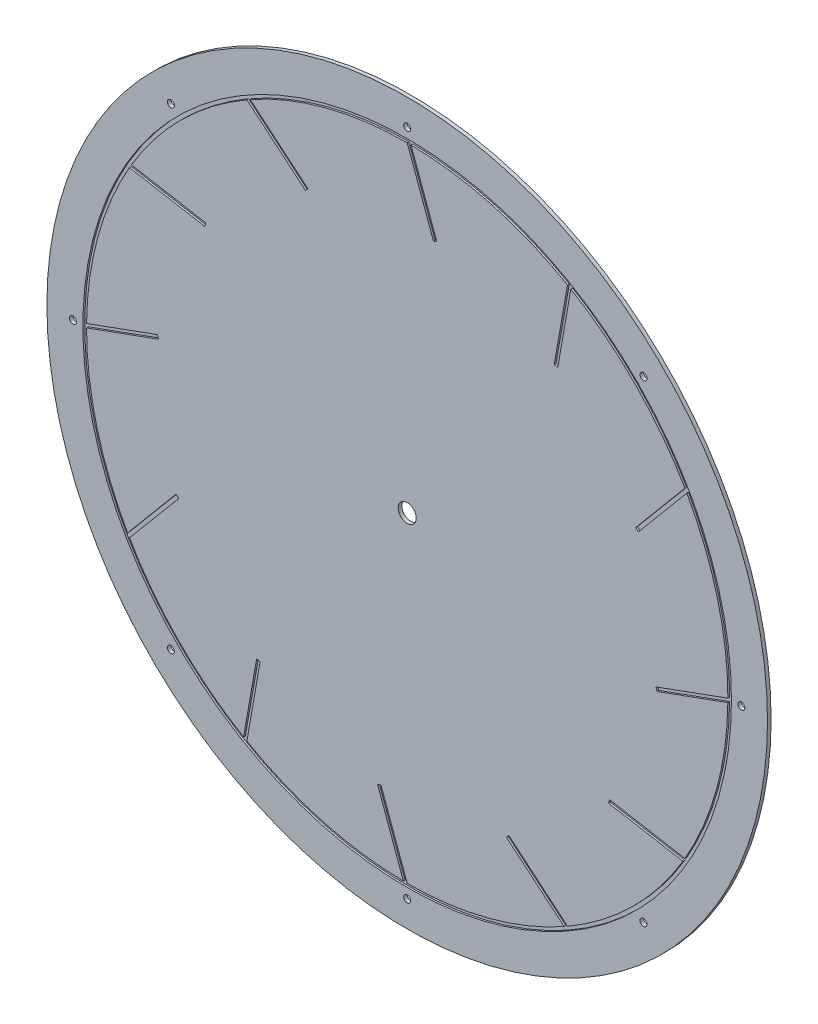
from build123d import *

# Parameters (mm, degrees)
SKETCH1_R                    = 254
BOSS_EXTRUDE1_DEPTH          = 2.54
SKETCH2_R                    = 228.6
SKETCH2_R_2                  = 226.06
CUT_EXTRUDE1_DEPTH           = 1.27
CUT_EXTRUDE2_DEPTH           = 1.27
SKETCH8_R                    = 6.35
CUT_EXTRUDE3_DEPTH           = 360.219224987
F_10_0_1935_DIAMETER_HOLE1_D = 4.9149


with BuildPart() as part:
    # Sketch1 → Boss-Extrude1 (new body)
    with BuildSketch(Plane.XY):
        Circle(SKETCH1_R)
    extrude(amount=BOSS_EXTRUDE1_DEPTH)

    # Sketch2 → Cut-Extrude1 (cut)
    with BuildSketch(Plane.XY.offset(2.54)):
        Circle(SKETCH2_R)
        Circle(SKETCH2_R_2, mode=Mode.SUBTRACT)
    extrude(amount=-CUT_EXTRUDE1_DEPTH, mode=Mode.SUBTRACT)

    # Sketch4 → Cut-Extrude2 (cut)
    with BuildSketch(Plane.XY.offset(2.54)):
        with BuildLine():
            Line((-226.06, 0), (-175.26, 18.489687901))
            Line((-175.26, 18.489687901), (-176.128731164, 20.876507158))
            Line((-176.128731164, 20.876507158), (-226.043768674, 2.708919262))
            ThreePointArc((-226.043768674, 2.708919262), (-226.055942132, 1.354483944), (-226.06, 0))
        make_face()
        with BuildLine():
            Line((-195.77370278, 113.03), (-142.534768317, 103.64253943))
            Line((-142.534768317, 103.64253943), (-142.093701946, 106.143951123))
            Line((-142.093701946, 106.143951123), (-194.405186408, 115.367877234))
            ThreePointArc((-194.405186408, 115.367877234), (-195.092946591, 114.200988571), (-195.77370278, 113.03))
        make_face()
        with BuildLine():
            Line((-113.03, 195.77370278), (-71.61746057, 161.024456218))
            Line((-71.61746057, 161.024456218), (-69.984780041, 162.970209103))
            Line((-69.984780041, 162.970209103), (-110.67589144, 197.11410567))
            ThreePointArc((-110.67589144, 197.11410567), (-111.854953561, 196.447430535), (-113.03, 195.77370278))
        make_face()
        with BuildLine():
            Line((0, 226.06), (18.489687901, 175.26))
            Line((18.489687901, 175.26), (20.876507158, 176.128731164))
            Line((20.876507158, 176.128731164), (2.708919262, 226.043768674))
            ThreePointArc((2.708919262, 226.043768674), (1.354483944, 226.055942132), (0, 226.06))
        make_face()
        with BuildLine():
            Line((113.03, 195.77370278), (103.64253943, 142.534768317))
            Line((103.64253943, 142.534768317), (106.143951123, 142.093701946))
            Line((106.143951123, 142.093701946), (115.367877234, 194.405186408))
            ThreePointArc((115.367877234, 194.405186408), (114.200988571, 195.092946591), (113.03, 195.77370278))
        make_face()
        with BuildLine():
            Line((195.77370278, 113.03), (161.024456218, 71.61746057))
            Line((161.024456218, 71.61746057), (162.970209103, 69.984780041))
            Line((162.970209103, 69.984780041), (197.11410567, 110.67589144))
            ThreePointArc((197.11410567, 110.67589144), (196.447430535, 111.854953561), (195.77370278, 113.03))
        make_face()
        with BuildLine():
            Line((226.06, 0), (175.26, -18.489687901))
            Line((175.26, -18.489687901), (176.128731164, -20.876507158))
            Line((176.128731164, -20.876507158), (226.043768674, -2.708919262))
            ThreePointArc((226.043768674, -2.708919262), (226.055942132, -1.354483944), (226.06, 0))
        make_face()
        with BuildLine():
            Line((195.77370278, -113.03), (142.534768317, -103.64253943))
            Line((142.534768317, -103.64253943), (142.093701946, -106.143951123))
            Line((142.093701946, -106.143951123), (194.405186408, -115.367877234))
            ThreePointArc((194.405186408, -115.367877234), (195.092946591, -114.200988571), (195.77370278, -113.03))
        make_face()
        with BuildLine():
            Line((113.03, -195.77370278), (71.61746057, -161.024456218))
            Line((71.61746057, -161.024456218), (69.984780041, -162.970209103))
            Line((69.984780041, -162.970209103), (110.67589144, -197.11410567))
            ThreePointArc((110.67589144, -197.11410567), (111.854953561, -196.447430535), (113.03, -195.77370278))
        make_face()
        with BuildLine():
            Line((0, -226.06), (-18.489687901, -175.26))
            Line((-18.489687901, -175.26), (-20.876507158, -176.128731164))
            Line((-20.876507158, -176.128731164), (-2.708919262, -226.043768674))
            ThreePointArc((-2.708919262, -226.043768674), (-1.354483944, -226.055942132), (0, -226.06))
        make_face()
        with BuildLine():
            Line((-113.03, -195.77370278), (-103.64253943, -142.534768317))
            Line((-103.64253943, -142.534768317), (-106.143951123, -142.093701946))
            Line((-106.143951123, -142.093701946), (-115.367877234, -194.405186408))
            ThreePointArc((-115.367877234, -194.405186408), (-114.200988571, -195.092946591), (-113.03, -195.77370278))
        make_face()
        with BuildLine():
            Line((-195.77370278, -113.03), (-161.024456218, -71.61746057))
            Line((-161.024456218, -71.61746057), (-162.970209103, -69.984780041))
            Line((-162.970209103, -69.984780041), (-197.11410567, -110.67589144))
            ThreePointArc((-197.11410567, -110.67589144), (-196.447430535, -111.854953561), (-195.77370278, -113.03))
        make_face()
    extrude(amount=-CUT_EXTRUDE2_DEPTH, mode=Mode.SUBTRACT)

    # Sketch8 → Cut-Extrude3 (cut, through all)
    with BuildSketch(Plane(origin=(0, 0, 0), x_dir=(-1, 0, 0), z_dir=(0, 0, -1))):
        Circle(SKETCH8_R)
    extrude(amount=-CUT_EXTRUDE3_DEPTH, mode=Mode.SUBTRACT)

    # #10 (0.1935) Diameter Hole1 (through all)
    with Locations(Plane.XY.offset(2.54)):
        with Locations((-235.585, 0), (-166.583751046, 166.583751046), (0, 235.585), (166.583751046, 166.583751046), (235.585, 0), (166.583751046, -166.583751046), (0, -235.585), (-166.583751046, -166.583751046)):
            Hole(F_10_0_1935_DIAMETER_HOLE1_D / 2)


solid = part.part
